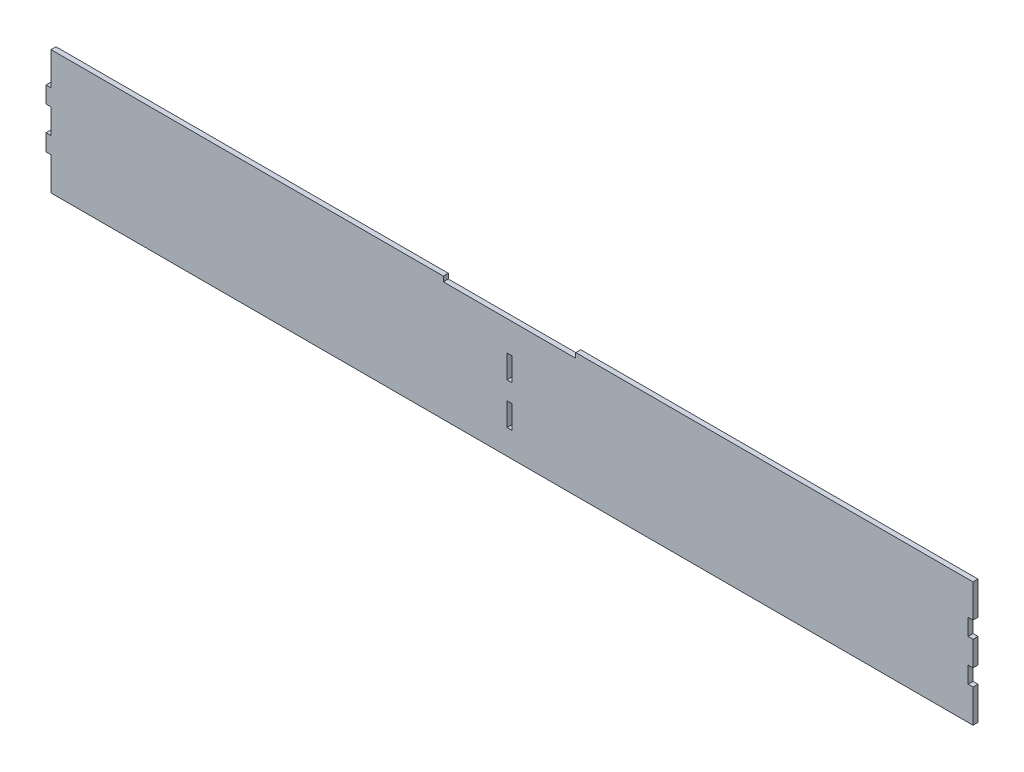
from build123d import *

# Parameters (mm, degrees)
SKETCH1_W           = 560
SKETCH1_H           = 75
BOSS_EXTRUDE1_DEPTH = 3
SKETCH2_W           = 3
SKETCH2_H           = 10
CUT_EXTRUDE1_DEPTH  = 3
SKETCH3_W           = 3
SKETCH3_H           = 20
SKETCH3_H_2         = 15
CUT_EXTRUDE2_DEPTH  = 3
SKETCH4_W           = 80
SKETCH4_H           = 3
CUT_EXTRUDE3_DEPTH  = 3
SKETCH5_W           = 3
SKETCH5_H           = 14
CUT_EXTRUDE4_DEPTH  = 10


with BuildPart() as part:
    # Sketch1 → Boss-Extrude1 (new body)
    with BuildSketch(Plane.XY):
        with Locations((47.655062333, 176.988975695)):
            Rectangle(SKETCH1_W, SKETCH1_H)
    extrude(amount=BOSS_EXTRUDE1_DEPTH)

    # Sketch2 → Cut-Extrude1 (cut)
    with BuildSketch(Plane.XY.offset(3)):
        with Locations((326.155062333, 189.488975695)):
            Rectangle(SKETCH2_W, SKETCH2_H)
        with Locations((326.155062333, 164.488975695)):
            Rectangle(SKETCH2_W, SKETCH2_H)
    extrude(amount=-CUT_EXTRUDE1_DEPTH, mode=Mode.SUBTRACT)

    # Sketch3 → Cut-Extrude2 (cut)
    with BuildSketch(Plane.XY.offset(3)):
        with Locations((-230.844937667, 204.488975695)):
            Rectangle(SKETCH3_W, SKETCH3_H)
        with Locations((-230.844937667, 149.488975695)):
            Rectangle(SKETCH3_W, SKETCH3_H)
        with Locations((-230.844937667, 176.988975695)):
            Rectangle(SKETCH3_W, SKETCH3_H_2)
    extrude(amount=-CUT_EXTRUDE2_DEPTH, mode=Mode.SUBTRACT)

    # Sketch4 → Cut-Extrude3 (cut)
    with BuildSketch(Plane.XY.offset(3)):
        with Locations((47.655062333, 212.988975695)):
            Rectangle(SKETCH4_W, SKETCH4_H)
    extrude(amount=-CUT_EXTRUDE3_DEPTH, mode=Mode.SUBTRACT)

    # Sketch5 → Cut-Extrude4 (cut)
    with BuildSketch(Plane.XY.offset(3)):
        with Locations((47.655062333, 186.488975695)):
            Rectangle(SKETCH5_W, SKETCH5_H)
        with Locations((47.655062333, 161.488975695)):
            Rectangle(SKETCH5_W, SKETCH5_H)
    extrude(amount=-CUT_EXTRUDE4_DEPTH, mode=Mode.SUBTRACT)


solid = part.part
